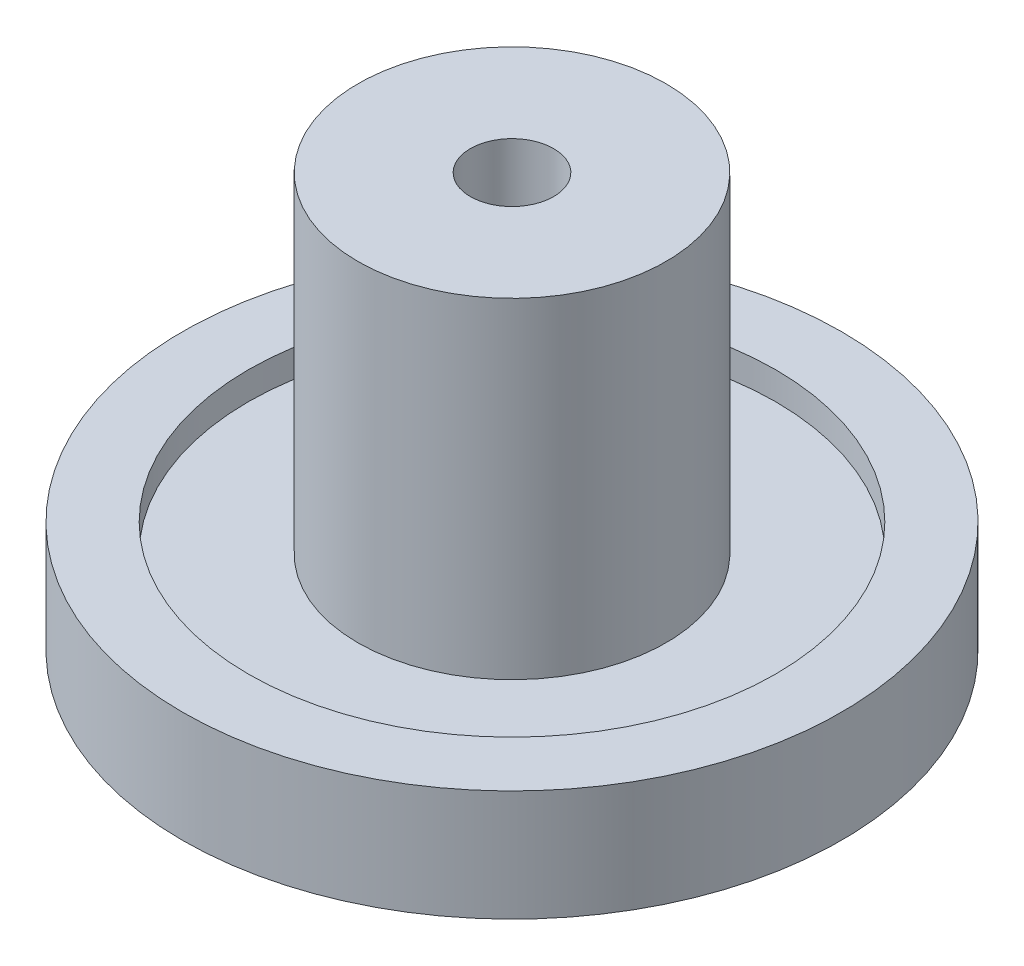
from build123d import *


with BuildPart() as part:
    # Sketch1 → 20 and 58 (revolve)
    with BuildSketch(Plane.XY, mode=Mode.PRIVATE) as f_20_and_58_sk:
        Polygon((1.5, 14.9), (1.5, 0), (3.5, 0), (3.5, 1.2), (9.5, 1.2), (9.5, 0), (11.875, 0), (11.875, 4), (9.5, 4), (9.5, 3), (5.55, 3), (5.55, 14.9), align=None)
    revolve(f_20_and_58_sk.sketch.rotate(Axis((0, 0, 0), (0, 1, 0)), 90), axis=Axis((0, 0, 0), (0, 1, 0)))


solid = part.part
